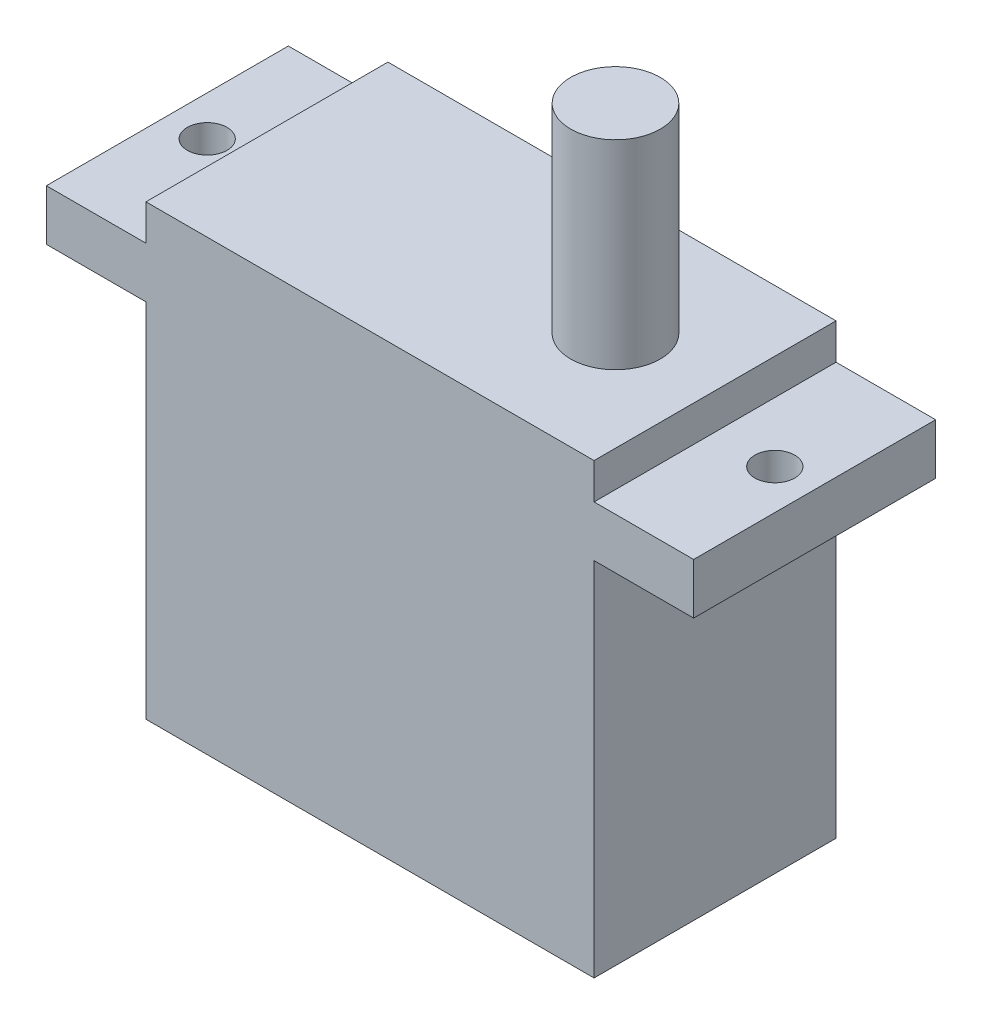
from build123d import *

# Parameters (mm, degrees)
SKETCH1_W           = 22.5
SKETCH1_H           = 12.15
BOSS_EXTRUDE1_DEPTH = 22.5
SKETCH2_W           = 12.15
SKETCH2_H           = 2.55
BOSS_EXTRUDE2_DEPTH = 5
SKETCH3_R           = 1
CUT_EXTRUDE1_DEPTH  = 2.55
SKETCH4_R           = 2.25
BOSS_EXTRUDE3_DEPTH = 10


with BuildPart() as part:
    # Sketch1 → Boss-Extrude1 (new body)
    with BuildSketch(Plane(origin=(0, 0, 0), x_dir=(1, 0, 0), z_dir=(0, 1, 0))):
        Rectangle(SKETCH1_W, SKETCH1_H)
    extrude(amount=BOSS_EXTRUDE1_DEPTH)

    # Sketch2 → Boss-Extrude2 (add)
    with BuildSketch(Plane(origin=(11.25, 0, 0), x_dir=(0, 0, -1), z_dir=(1, 0, 0))):
        with Locations((0, 19.425)):
            Rectangle(SKETCH2_W, SKETCH2_H)
    boss_extrude2 = extrude(amount=BOSS_EXTRUDE2_DEPTH)

    # Sketch3 → Cut-Extrude1 (cut)
    with BuildSketch(Plane(origin=(0, 20.7, 0), x_dir=(1, 0, 0), z_dir=(0, 1, 0))):
        with Locations(Location((14.25, 0, 0), (0, 0, 270))):
            Circle(SKETCH3_R)
    cut_extrude1 = extrude(amount=-CUT_EXTRUDE1_DEPTH, mode=Mode.SUBTRACT)

    # Mirror1: Boss-Extrude2, Cut-Extrude1 across plane
    add(boss_extrude2.mirror(Plane(origin=(0, 0, 0), x_dir=(0, 0, 1), z_dir=(1, 0, 0))))
    add(cut_extrude1.mirror(Plane(origin=(0, 0, 0), x_dir=(0, 0, 1), z_dir=(1, 0, 0))), mode=Mode.SUBTRACT)

    # Sketch4 → Boss-Extrude3 (add)
    with BuildSketch(Plane(origin=(0, 22.5, 0), x_dir=(1, 0, 0), z_dir=(0, 1, 0))):
        with Locations(Location((6.25, 0, 0), (0, 0, 270))):
            Circle(SKETCH4_R)
    extrude(amount=BOSS_EXTRUDE3_DEPTH)


solid = part.part
